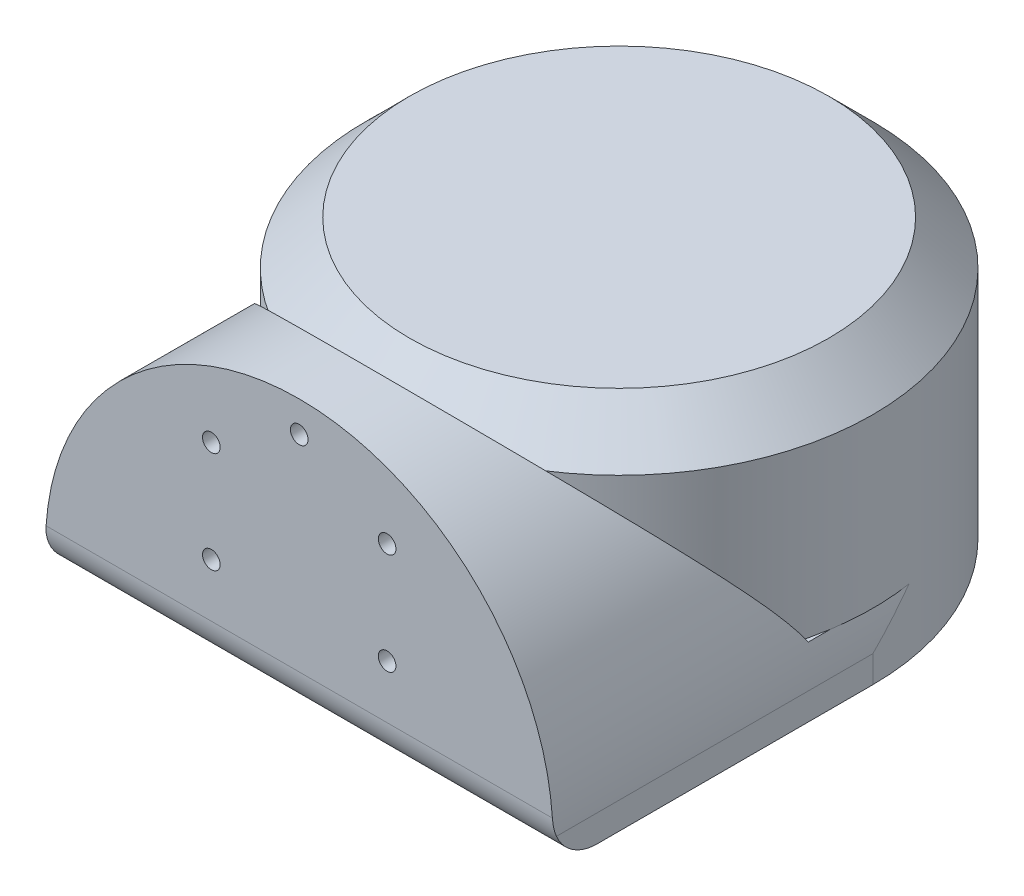
from build123d import *

# Parameters (mm, degrees)
SKETCH1_R           = 1.5000000000045177
SKETCH1_R_2         = 1.5000000000039286
SKETCH1_R_3         = 1.5000000000048885
SKETCH1_R_4         = 1.5000000000030813
SKETCH1_R_5         = 1.5000000000049234
SKETCH1_R_6         = 1.5000000000046225
SKETCH1_R_7         = 1.5000000000039988
SKETCH1_R_8         = 1.5000000000031655
SKETCH1_R_9         = 1.5000000000021898
SKETCH1_R_10        = 1.500000000001496
SKETCH1_R_11        = 1.5000000000000056
SKETCH1_R_12        = 1.5000000000000024
SKETCH1_R_13        = 1.5000000000022253
SKETCH1_R_14        = 1.5000000000000009
SKETCH1_R_15        = 1.500000000001335
SKETCH1_R_16        = 1.5000000000006002
BOSS_EXTRUDE1_DEPTH = 15
BOSS_EXTRUDE2_DEPTH = 115
CUT_EXTRUDE1_REACH  = 114.283
SKETCH3_R           = 58.5
SKETCH5_R           = 2.0000000000000004
SKETCH5_R_2         = 1.9999999999999987
SKETCH5_R_3         = 2.000000000000004
SKETCH5_R_4         = 1.9999999999999991
SKETCH5_R_5         = 2.000000000000002
CUT_EXTRUDE3_DEPTH  = 75.59999999999997
SKETCH6_R           = 4.250000000000001
SKETCH6_R_2         = 4.249999999999999
SKETCH6_R_3         = 4.249999999999998
CUT_EXTRUDE4_DEPTH  = 62.5
CUT_EXTRUDE2_DEPTH  = 132.60000000000002
FILLET1_R           = 10
SKETCH8_R           = 57.500000000000014
BOSS_EXTRUDE3_DEPTH = 48.00000000000003
CHAMFER1_SIZE       = 10


with BuildPart() as part:
    # Sketch1 → Boss-Extrude1 (new body)
    # profile 1 of 3: a face of its own
    with BuildSketch(Plane(origin=(0, 0, 0), x_dir=(1, 0, 0), z_dir=(0, 1, 0))):
        with BuildLine():
            ThreePointArc((57.50000000000001, 0), (3.52e-15, 57.50000000000001), (-57.50000000000001, 7.04e-15))
            ThreePointArc((-57.50000000000001, 7.04e-15), (-40.65863990880856, -40.658639927644415), (2.663793018e-08, -57.50000000000001))
            ThreePointArc((2.663793018e-08, -57.50000000000001), (40.658639927644415, -40.65863990880856), (57.50000000000001, -1.408e-14))
        make_face()
        with Locations(Location((-30.00079258305468, -44.899359064338086, 0), (0, 0, 270))):
            Circle(SKETCH1_R, mode=Mode.SUBTRACT)
        with Locations(Location((-44.89935906433412, -30.000792583059706, 0), (0, 0, 270))):
            Circle(SKETCH1_R_2, mode=Mode.SUBTRACT)
        with Locations(Location((-10.534877388866802, -52.96240514177439, 0), (0, 0, 270))):
            Circle(SKETCH1_R_3, mode=Mode.SUBTRACT)
        with Locations(Location((-52.96240514177183, -10.534877388872381, 0), (0, 0, 270))):
            Circle(SKETCH1_R_4, mode=Mode.SUBTRACT)
        with Locations(Location((10.534877388875055, -52.96240514177364, 0), (0, 0, 270))):
            Circle(SKETCH1_R_5, mode=Mode.SUBTRACT)
        with Locations(Location((30.000792583062363, -44.89935906433594, 0), (0, 0, 270))):
            Circle(SKETCH1_R_6, mode=Mode.SUBTRACT)
        with Locations(Location((44.89935906434075, -30.000792583056487, 0), (0, 0, 270))):
            Circle(SKETCH1_R_7, mode=Mode.SUBTRACT)
        with Locations(Location((52.96240514177706, -10.534877388868606, 0), (0, 0, 270))):
            Circle(SKETCH1_R_8, mode=Mode.SUBTRACT)
        with Locations(Location((-52.962405141772585, 10.534877388869498, 0), (0, 0, 270))):
            Circle(SKETCH1_R_9, mode=Mode.SUBTRACT)
        with Locations(Location((-44.89935906433628, 30.000792583057358, 0), (0, 0, 270))):
            Circle(SKETCH1_R_10, mode=Mode.SUBTRACT)
        with Locations(Location((-30.000792583057606, 44.899359064338036, 0), (0, 0, 270))):
            Circle(SKETCH1_R_11, mode=Mode.SUBTRACT)
        with Locations(Location((-10.534877388870568, 52.962405141774504, 0), (0, 0, 270))):
            Circle(SKETCH1_R_12, mode=Mode.SUBTRACT)
        with Locations(Location((52.962405141776316, 10.53487738887325, 0), (0, 0, 270))):
            Circle(SKETCH1_R_13, mode=Mode.SUBTRACT)
        with Locations(Location((10.534877388871328, 52.96240514177437, 0), (0, 0, 270))):
            Circle(SKETCH1_R_14, mode=Mode.SUBTRACT)
        with Locations(Location((44.89935906433862, 30.000792583060555, 0), (0, 0, 270))):
            Circle(SKETCH1_R_15, mode=Mode.SUBTRACT)
        with Locations(Location((30.00079258305917, 44.89935906433896, 0), (0, 0, 270))):
            Circle(SKETCH1_R_16, mode=Mode.SUBTRACT)
    # profile 2 of 3: a face of its own
    with BuildSketch(Plane(origin=(0, 0, 0), x_dir=(1, 0, 0), z_dir=(0, 1, 0))):
        with BuildLine():
            ThreePointArc((2.663793018e-08, -57.50000000000001), (-40.65863990880856, -40.658639927644415), (-57.50000000000001, 7.04e-15))
            Line((-57.50000000000001, 0), (-57.5, -57.50000000000001))
            Line((-57.5, -57.50000000000001), (2.663792742e-08, -57.50000000000001))
        make_face()
    # profile 3 of 3: a face of its own
    with BuildSketch(Plane(origin=(0, 0, 0), x_dir=(1, 0, 0), z_dir=(0, 1, 0))):
        with BuildLine():
            Line((57.5, -57.50000000000001), (57.50000000000001, 0))
            ThreePointArc((57.50000000000001, -1.408e-14), (40.658639927644415, -40.65863990880856), (2.663793018e-08, -57.50000000000001))
            Line((2.663792742e-08, -57.50000000000001), (57.5, -57.50000000000001))
        make_face()
    extrude(amount=BOSS_EXTRUDE1_DEPTH)

    # Sketch2 → Boss-Extrude2 (add)
    with BuildSketch(Plane.ZY.offset(57.50000000000001)):
        Polygon((57.5, 15), (57.5, 0), (72.50000000000001, -5.2e-16), (72.5, 63.6), (57.5, 63.6), align=None)
        Polygon((-6.94e-15, 15), (57.5, 15), (57.5, 63.6), align=None)
    extrude(amount=-BOSS_EXTRUDE2_DEPTH)

    # Cut-Extrude1: up to this face of the body (flat: up to its plane)
    cut_extrude1_end = Plane(part.part.faces().sort_by_distance((0, 15, -24.291521377))[0])
    # Sketch3 → Cut-Extrude1 (cut, up to the picked face)
    with BuildSketch(Plane(origin=(0, 63.6, 0), x_dir=(1, 0, 0), z_dir=(0, 1, 0)), mode=Mode.PRIVATE) as cut_extrude1_sk1:
        Circle(SKETCH3_R)
    cut_extrude1_tool1 = split(extrude(cut_extrude1_sk1.sketch, amount=-CUT_EXTRUDE1_REACH, mode=Mode.PRIVATE), bisect_by=cut_extrude1_end, keep=Keep.BOTH, mode=Mode.PRIVATE)
    add(cut_extrude1_tool1.solids().sort_by(Axis((0, 63.6, 0), (0, -1, 0)))[0], mode=Mode.SUBTRACT)

    # Sketch5 → Cut-Extrude3 (cut)
    with BuildSketch(Plane.XY.offset(72.50000000000001)):
        with Locations((5.2e-15, 56.6)):
            Circle(SKETCH5_R)
        with Locations((-19.918584287041796, 45.09999999999939)):
            Circle(SKETCH5_R_2)
        with Locations((-19.91858428704105, 22.09999999999935)):
            Circle(SKETCH5_R_3)
        with Locations((19.91858428704318, 22.100000000000755)):
            Circle(SKETCH5_R_4)
        with Locations((19.918584287042275, 45.10000000000079)):
            Circle(SKETCH5_R_5)
    extrude(amount=-CUT_EXTRUDE3_DEPTH, mode=Mode.SUBTRACT)

    # Sketch6 → Cut-Extrude4 (cut)
    with BuildSketch(Plane.XY):
        with Locations(Location((0, 56.6, 0), (0, 0, 270))):
            Circle(SKETCH6_R)
        with Locations(Location((19.91858428704245, 45.10000000000051, 0), (0, 0, 180))):
            Circle(SKETCH6_R_2)
        with Locations(Location((19.918584287043004, 22.100000000000474, 0), (0, 0, 180))):
            Circle(SKETCH6_R_3)
        with Locations(Location((-19.918584287041227, 22.09999999999962, 0), (0, 0, 180))):
            Circle(SKETCH6_R_3)
        with Locations(Location((-19.91858428704162, 45.099999999999675, 0), (0, 0, 180))):
            Circle(SKETCH6_R_2)
    extrude(amount=CUT_EXTRUDE4_DEPTH, mode=Mode.SUBTRACT)

    # Sketch4 → Cut-Extrude2 (cut)
    with BuildSketch(Plane.XY.offset(72.50000000000001)):
        with BuildLine():
            Line((-57.50000000000001, 63.6), (-57.50000000000001, 6.100000000099333))
            ThreePointArc((-57.49999999999999, 6.100000000099347), (-40.65863990954862, 46.758639926904344), (2.444534008e-08, 63.60000000000001))
            Line((2.444533997e-08, 63.6), (-10.77032961426894, 63.6))
            Line((-10.770329614268938, 63.6), (-57.50000000000001, 63.6))
        make_face()
        with BuildLine():
            Line((57.50000000000001, 63.6), (2.444533997e-08, 63.6))
            ThreePointArc((2.444535285e-08, 63.60000000000001), (40.65863992686923, 46.758639909583756), (57.50000000000001, 6.1000000000000085))
            Line((57.500000000000036, 6.1000000000000085), (57.5, 63.6))
        make_face()
    extrude(amount=-CUT_EXTRUDE2_DEPTH, mode=Mode.SUBTRACT)

    # Fillet1
    fillet1_edges = [part.edges().sort_by_distance(p)[0] for p in [
        (0, -2.6e-16, 72.50000000000001),
    ]]
    fillet(fillet1_edges, radius=FILLET1_R)

    # Sketch8 → Boss-Extrude3 (add)
    with BuildSketch(Plane(origin=(0, 15, 0), x_dir=(1, 0, 0), z_dir=(0, 1, 0))):
        with Locations(Location((0, 0, 0), (0, 0, 171.095811508))):
            Circle(SKETCH8_R)
    extrude(amount=BOSS_EXTRUDE3_DEPTH)

    # Chamfer1
    chamfer1_edges = [part.edges().sort_by_distance(p)[0] for p in [
        (56.80704181704294, 63.00000000000003, 8.899999999816629),
    ]]
    chamfer(chamfer1_edges, length=CHAMFER1_SIZE)


solid = part.part
